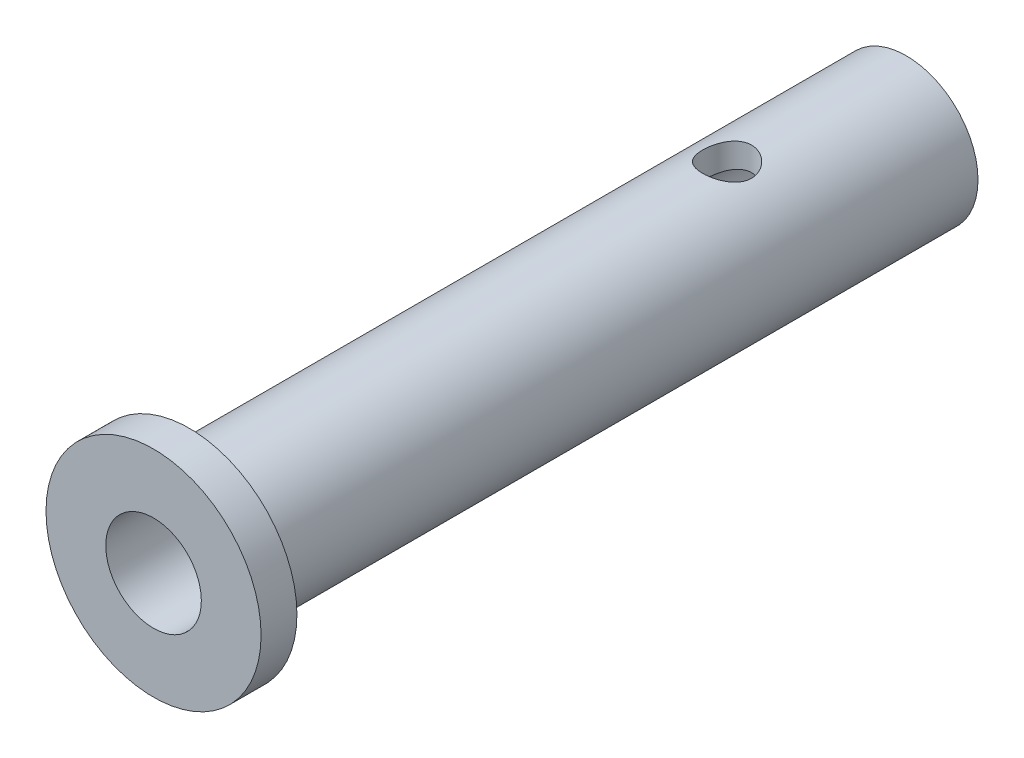
from build123d import *

# Parameters (mm, degrees)
SKETCH_1_R          = 6
SKETCH_1_R_2        = 4
EXTRUDE_1_DEPTH     = 60
SKETCH_2_R          = 9
SKETCH_2_R_2        = 4
EXTRUDE_2_DEPTH     = 3
SKETCH_3_R          = 2.05
CUT_EXTRUDE_1_DEPTH = 25


with BuildPart() as part:
    # 草图1 → 凸台-拉伸1 (new body)
    with BuildSketch(Plane.XY):
        Circle(SKETCH_1_R)
        Circle(SKETCH_1_R_2, mode=Mode.SUBTRACT)
    extrude(amount=EXTRUDE_1_DEPTH)

    # 草图2 → 凸台-拉伸2 (add)
    with BuildSketch(Plane.XY.offset(60)):
        Circle(SKETCH_2_R)
        Circle(SKETCH_2_R_2, mode=Mode.SUBTRACT)
    extrude(amount=EXTRUDE_2_DEPTH)

    # 草图3 → 切除-拉伸1 (cut, symmetric)
    with BuildSketch(Plane(origin=(0, 0, 0), x_dir=(1, 0, 0), z_dir=(0, 1, 0))):
        with Locations(Location((0, -15, 0), (0, 0, 270))):
            Circle(SKETCH_3_R)
    extrude(amount=CUT_EXTRUDE_1_DEPTH, both=True, mode=Mode.SUBTRACT)


solid = part.part
